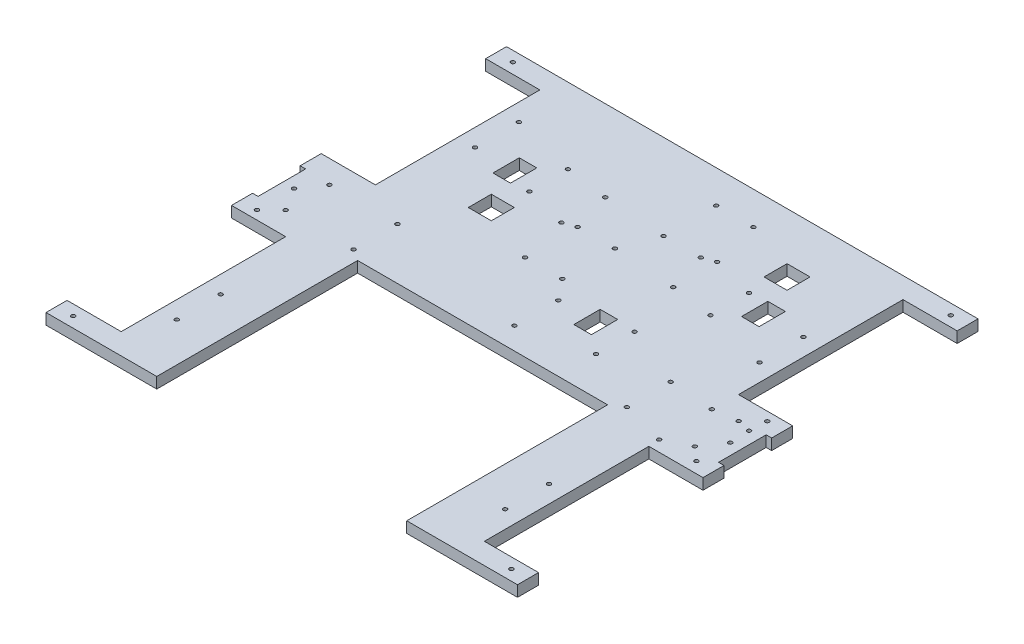
from build123d import *

# Parameters (mm, degrees)
BOSS_EXTRUDE1_DEPTH = 6.35
SKETCH3_R           = 1.1303
SKETCH3_W           = 10.16
SKETCH3_H           = 15.24
CUT_EXTRUDE1_DEPTH  = 6.35
SKETCH5_W           = 28.194
SKETCH5_H           = 95.25
CUT_EXTRUDE2_DEPTH  = 6.35
SKETCH6_W           = 13.337799598
SKETCH6_H           = 13.337799598
CUT_EXTRUDE3_DEPTH  = 6.35
SKETCH7_R           = 1.1303
CUT_EXTRUDE4_DEPTH  = 16.002
SKETCH8_R           = 1.1303
SKETCH8_W           = 10.16
SKETCH8_H           = 15.24
CUT_EXTRUDE5_DEPTH  = 6.35
SKETCH9_W           = 12.065
SKETCH9_H           = 6.35
SKETCH9_W_2         = 12.192
BOSS_EXTRUDE2_DEPTH = 3.175
SKETCH10_W          = 12.192
SKETCH10_H          = 6.35
SKETCH10_W_2        = 12.065
BOSS_EXTRUDE3_DEPTH = 3.175
SKETCH12_R          = 1.1303
CUT_EXTRUDE7_DEPTH  = 19.05
SKETCH14_R          = 1.1303
CUT_EXTRUDE8_DEPTH  = 6.35
SKETCH15_R          = 1.1303
CUT_EXTRUDE9_DEPTH  = 6.35


with BuildPart() as part:
    # Sketch1 → Boss-Extrude1 (new body)
    with BuildSketch(Plane(origin=(0, 0, 0), x_dir=(1, 0, 0), z_dir=(0, 1, 0))):
        Polygon((0, 0), (60.96, 0), (60.96, 116.332), (205.74, 116.332), (205.74, 0), (266.7, 0), (266.7, 266.7), (0, 266.7), align=None)
    extrude(amount=BOSS_EXTRUDE1_DEPTH)

    # Sketch3 → Cut-Extrude1 (cut)
    with BuildSketch(Plane.XZ):
        with Locations(Location((38.2651, -232.41, 0), (0, 0, 270))):
            Circle(SKETCH3_R)
        with Locations(Location((38.2651, -207.01, 0), (0, 0, 270))):
            Circle(SKETCH3_R)
        with Locations(Location((76.0857, -223.012, 0), (0, 0, 270))):
            Circle(SKETCH3_R)
        with Locations(Location((76.0857, -200.66, 0), (0, 0, 270))):
            Circle(SKETCH3_R)
        with Locations(Location((107.8611, -166.37, 0), (0, 0, 270))):
            Circle(SKETCH3_R)
        with Locations(Location((107.8611, -196.85, 0), (0, 0, 270))):
            Circle(SKETCH3_R)
        with Locations(Location((129.4511, -166.37, 0), (0, 0, 270))):
            Circle(SKETCH3_R)
        with Locations(Location((129.4511, -196.85, 0), (0, 0, 270))):
            Circle(SKETCH3_R)
        with Locations(Location((137.2743, -217.17, 0), (0, 0, 270))):
            Circle(SKETCH3_R)
        with Locations(Location((158.8643, -217.17, 0), (0, 0, 270))):
            Circle(SKETCH3_R)
        with Locations(Location((137.2743, -247.65, 0), (0, 0, 270))):
            Circle(SKETCH3_R)
        with Locations(Location((158.8643, -247.65, 0), (0, 0, 270))):
            Circle(SKETCH3_R)
        with Locations(Location((190.5889, -191.008, 0), (0, 0, 270))):
            Circle(SKETCH3_R)
        with Locations(Location((190.5889, -213.36, 0), (0, 0, 270))):
            Circle(SKETCH3_R)
        with Locations(Location((228.4349, -181.61, 0), (0, 0, 270))):
            Circle(SKETCH3_R)
        with Locations(Location((228.4349, -207.01, 0), (0, 0, 270))):
            Circle(SKETCH3_R)
        with Locations((205.3209, -207.01)):
            Rectangle(SKETCH3_W, SKETCH3_H)
        with Locations((61.3537, -207.01)):
            Rectangle(SKETCH3_W, SKETCH3_H)
    extrude(amount=-CUT_EXTRUDE1_DEPTH, mode=Mode.SUBTRACT)

    # Sketch5 → Cut-Extrude2 (cut)
    with BuildSketch(Plane(origin=(0, 0, 0), x_dir=(1, 0, 0), z_dir=(0, 1, 0))):
        with Locations((14.097, 207.01)):
            Rectangle(SKETCH5_W, SKETCH5_H)
        with Locations((252.603, 207.01)):
            Rectangle(SKETCH5_W, SKETCH5_H)
        with Locations((252.603, 59.817)):
            Rectangle(SKETCH5_W, SKETCH5_H)
        with Locations((14.097, 59.817)):
            Rectangle(SKETCH5_W, SKETCH5_H)
    extrude(amount=CUT_EXTRUDE2_DEPTH, mode=Mode.SUBTRACT)

    # Sketch6 → Cut-Extrude3 (cut)
    with BuildSketch(Plane(origin=(0, 6.35, 0), x_dir=(1, 0, 0), z_dir=(0, 1, 0))):
        with Locations((73.102599799, 181.61)):
            Rectangle(SKETCH6_W, SKETCH6_H)
        with Locations((193.572000201, 232.41)):
            Rectangle(SKETCH6_W, SKETCH6_H)
    extrude(amount=-CUT_EXTRUDE3_DEPTH, mode=Mode.SUBTRACT)

    # Sketch7 → Cut-Extrude4 (cut)
    with BuildSketch(Plane.XZ):
        with Locations(Location((38.2651, -34.29, 0), (0, 0, 270))):
            Circle(SKETCH7_R)
        with Locations(Location((38.2651, -59.69, 0), (0, 0, 270))):
            Circle(SKETCH7_R)
        with Locations(Location((228.4349, -34.29, 0), (0, 0, 270))):
            Circle(SKETCH7_R)
        with Locations(Location((228.4349, -59.69, 0), (0, 0, 270))):
            Circle(SKETCH7_R)
    extrude(amount=-CUT_EXTRUDE4_DEPTH, mode=Mode.SUBTRACT)

    # Sketch8 → Cut-Extrude5 (cut)
    with BuildSketch(Plane(origin=(0, 6.35, 0), x_dir=(1, 0, 0), z_dir=(0, 1, 0))):
        with Locations(Location((14.859, 146.1135, 0), (0, 0, 270))):
            Circle(SKETCH8_R)
        with Locations(Location((14.859, 120.7135, 0), (0, 0, 270))):
            Circle(SKETCH8_R)
        with Locations(Location((54.229, 146.1135, 0), (0, 0, 270))):
            Circle(SKETCH8_R)
        with Locations(Location((54.229, 120.7135, 0), (0, 0, 270))):
            Circle(SKETCH8_R)
        with Locations(Location((212.471, 146.1135, 0), (0, 0, 270))):
            Circle(SKETCH8_R)
        with Locations(Location((212.471, 120.7135, 0), (0, 0, 270))):
            Circle(SKETCH8_R)
        with Locations(Location((251.841, 120.7135, 0), (0, 0, 270))):
            Circle(SKETCH8_R)
        with Locations(Location((251.841, 146.1135, 0), (0, 0, 270))):
            Circle(SKETCH8_R)
        with Locations(Location((139.065, 154.432, 0), (0, 0, 270))):
            Circle(SKETCH8_R)
        with Locations(Location((139.065, 129.032, 0), (0, 0, 270))):
            Circle(SKETCH8_R)
        with Locations(Location((176.911, 160.782, 0), (0, 0, 270))):
            Circle(SKETCH8_R)
        with Locations(Location((176.911, 138.43, 0), (0, 0, 270))):
            Circle(SKETCH8_R)
        with Locations(Location((238.125, 144.272, 0), (0, 0, 270))):
            Circle(SKETCH8_R)
        with Locations(Location((238.125, 113.792, 0), (0, 0, 270))):
            Circle(SKETCH8_R)
        with Locations(Location((259.715, 144.272, 0), (0, 0, 270))):
            Circle(SKETCH8_R)
        with Locations(Location((259.715, 113.792, 0), (0, 0, 270))):
            Circle(SKETCH8_R)
        with Locations((160.782, 154.432)):
            Rectangle(SKETCH8_W, SKETCH8_H)
    extrude(amount=-CUT_EXTRUDE5_DEPTH, mode=Mode.SUBTRACT)

    # Sketch9 → Boss-Extrude2 (add)
    with BuildSketch(Plane.ZY):
        with Locations((-260.6675, 3.175)):
            Rectangle(SKETCH9_W, SKETCH9_H)
        with Locations((-6.096, 3.175)):
            Rectangle(SKETCH9_W_2, SKETCH9_H)
        with Locations((-153.289, 3.175)):
            Rectangle(SKETCH9_W_2, SKETCH9_H)
        with Locations((-113.538, 3.175)):
            Rectangle(SKETCH9_W_2, SKETCH9_H)
    extrude(amount=BOSS_EXTRUDE2_DEPTH)

    # Sketch10 → Boss-Extrude3 (add)
    with BuildSketch(Plane(origin=(266.7, 0, 0), x_dir=(0, 0, -1), z_dir=(1, 0, 0))):
        with Locations((6.096, 3.175)):
            Rectangle(SKETCH10_W, SKETCH10_H)
        with Locations((113.538, 3.175)):
            Rectangle(SKETCH10_W, SKETCH10_H)
        with Locations((153.289, 3.175)):
            Rectangle(SKETCH10_W, SKETCH10_H)
        with Locations((260.6675, 3.175)):
            Rectangle(SKETCH10_W_2, SKETCH10_H)
    extrude(amount=BOSS_EXTRUDE3_DEPTH)

    # Sketch12 → Cut-Extrude7 (cut)
    with BuildSketch(Plane(origin=(0, 6.35, 0), x_dir=(1, 0, 0), z_dir=(0, 1, 0))):
        with Locations(Location((100.965, 219.71, 0), (0, 0, 270))):
            Circle(SKETCH12_R)
        with Locations(Location((100.965, 194.31, 0), (0, 0, 270))):
            Circle(SKETCH12_R)
        with Locations(Location((165.735, 219.71, 0), (0, 0, 270))):
            Circle(SKETCH12_R)
        with Locations(Location((165.735, 194.31, 0), (0, 0, 270))):
            Circle(SKETCH12_R)
    extrude(amount=-CUT_EXTRUDE7_DEPTH, mode=Mode.SUBTRACT)

    # Sketch14 → Cut-Extrude8 (cut)
    with BuildSketch(Plane.XZ):
        with Locations(Location((6.477, -133.985, 0), (0, 0, 270))):
            Circle(SKETCH14_R)
        with Locations(Location((6.477, -112.522, 0), (0, 0, 270))):
            Circle(SKETCH14_R)
        with Locations(Location((260.223, -132.842, 0), (0, 0, 270))):
            Circle(SKETCH14_R)
        with Locations(Location((260.223, -154.305, 0), (0, 0, 270))):
            Circle(SKETCH14_R)
    extrude(amount=-CUT_EXTRUDE8_DEPTH, mode=Mode.SUBTRACT)

    # Sketch15 → Cut-Extrude9 (cut)
    with BuildSketch(Plane.XZ):
        with Locations(Location((6.477, -6.096, 0), (0, 0, 270))):
            Circle(SKETCH15_R)
        with Locations(Location((6.477, -260.722358198, 0), (0, 0, 270))):
            Circle(SKETCH15_R)
        with Locations(Location((260.223, -260.604, 0), (0, 0, 270))):
            Circle(SKETCH15_R)
        with Locations(Location((260.223, -6.096, 0), (0, 0, 270))):
            Circle(SKETCH15_R)
    extrude(amount=-CUT_EXTRUDE9_DEPTH, mode=Mode.SUBTRACT)


solid = part.part
